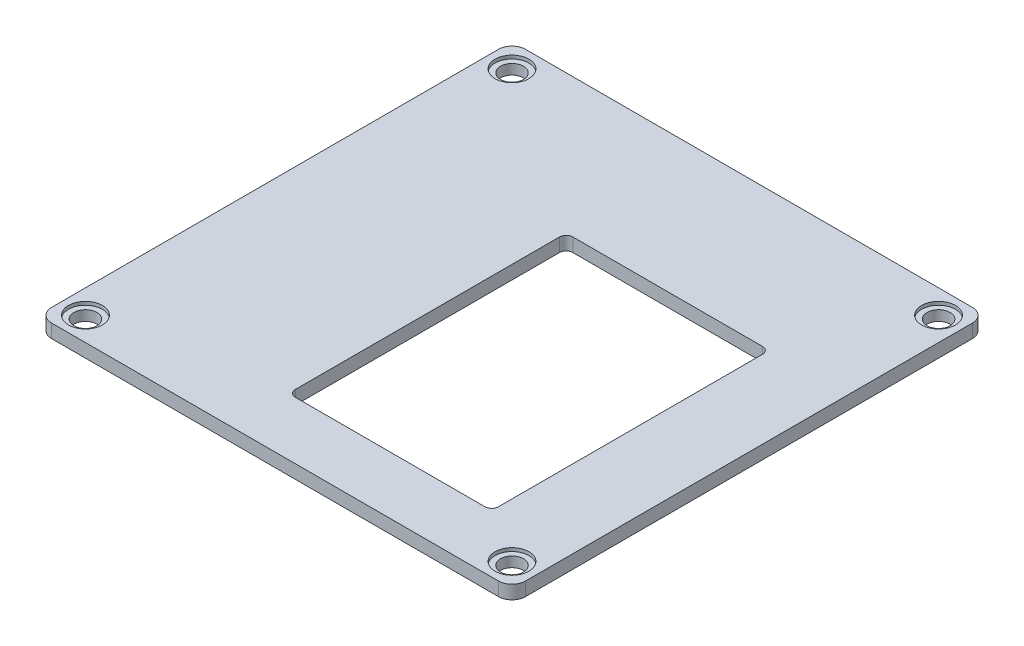
from build123d import *

# Parameters (mm, degrees)
SKETCH_1_W          = 70
SKETCH_1_H          = 70
SKETCH_1_R          = 1.7
SKETCH_1_W_2        = 30
SKETCH_1_H_2        = 41
EXTRUDE_1_DEPTH     = 2
FILLET_1_R          = 2
FILLET_2_R          = 1
CUT_EXTRUDE_START   = -0.5
SKETCH_2_R          = 2.5
SKETCH_2_R_2        = 1.7
CUT_EXTRUDE_1_DEPTH = 0.5


with BuildPart() as part:
    # 草图1 → 凸台-拉伸1 (new body)
    with BuildSketch(Plane(origin=(0, 0, 0), x_dir=(1, 0, 0), z_dir=(0, 1, 0))):
        with Locations((-3.5, 3.5)):
            Rectangle(SKETCH_1_W, SKETCH_1_H)
        with Locations(Location((28, -28, 0), (0, 0, 270))):
            Circle(SKETCH_1_R, mode=Mode.SUBTRACT)
        with Locations(Location((28, 35, 0), (0, 0, 270))):
            Circle(SKETCH_1_R, mode=Mode.SUBTRACT)
        with Locations(Location((-35, -28, 0), (0, 0, 90))):
            Circle(SKETCH_1_R, mode=Mode.SUBTRACT)
        with Locations(Location((-35, 35, 0), (0, 0, 90))):
            Circle(SKETCH_1_R, mode=Mode.SUBTRACT)
        with Locations((5, -2.5)):
            Rectangle(SKETCH_1_W_2, SKETCH_1_H_2, mode=Mode.SUBTRACT)
    extrude(amount=EXTRUDE_1_DEPTH)

    # 圆角1
    fillet_1_edges = [part.edges().sort_by_distance(p)[0] for p in [
        (-38.5, 1, -38.5),
        (31.5, 1, -38.5),
        (31.5, 1, 31.5),
        (-38.5, 1, 31.5),
    ]]
    fillet(fillet_1_edges, radius=FILLET_1_R)

    # 圆角2
    fillet_2_edges = [part.edges().sort_by_distance(p)[0] for p in [
        (-10, 1, -18),
        (-10, 1, 23),
        (20, 1, 23),
        (20, 1, -18),
    ]]
    fillet(fillet_2_edges, radius=FILLET_2_R)

    # 草图2 → 切除-拉伸1 (cut)
    # profile 1 of 4: a face of its own
    with BuildSketch(Plane(origin=(0, 2, 0), x_dir=(1, 0, 0), z_dir=(0, 1, 0)).offset(CUT_EXTRUDE_START)):
        with Locations(Location((-35, 35, 0), (0, 0, 270))):
            Circle(SKETCH_2_R)
        with Locations(Location((-35, 35, 0), (0, 0, 90))):
            Circle(SKETCH_2_R_2, mode=Mode.SUBTRACT)
    # profile 2 of 4: a face of its own
    with BuildSketch(Plane(origin=(0, 2, 0), x_dir=(1, 0, 0), z_dir=(0, 1, 0)).offset(CUT_EXTRUDE_START)):
        with Locations(Location((28, 35, 0), (0, 0, 270))):
            Circle(SKETCH_2_R)
        with Locations(Location((28, 35, 0), (0, 0, 270))):
            Circle(SKETCH_2_R_2, mode=Mode.SUBTRACT)
    # profile 3 of 4: a face of its own
    with BuildSketch(Plane(origin=(0, 2, 0), x_dir=(1, 0, 0), z_dir=(0, 1, 0)).offset(CUT_EXTRUDE_START)):
        with Locations(Location((28, -28, 0), (0, 0, 270))):
            Circle(SKETCH_2_R)
        with Locations(Location((28, -28, 0), (0, 0, 270))):
            Circle(SKETCH_2_R_2, mode=Mode.SUBTRACT)
    # profile 4 of 4: a face of its own
    with BuildSketch(Plane(origin=(0, 2, 0), x_dir=(1, 0, 0), z_dir=(0, 1, 0)).offset(CUT_EXTRUDE_START)):
        with Locations(Location((-35, -28, 0), (0, 0, 270))):
            Circle(SKETCH_2_R)
        with Locations(Location((-35, -28, 0), (0, 0, 90))):
            Circle(SKETCH_2_R_2, mode=Mode.SUBTRACT)
    extrude(amount=CUT_EXTRUDE_1_DEPTH, mode=Mode.SUBTRACT)


solid = part.part
